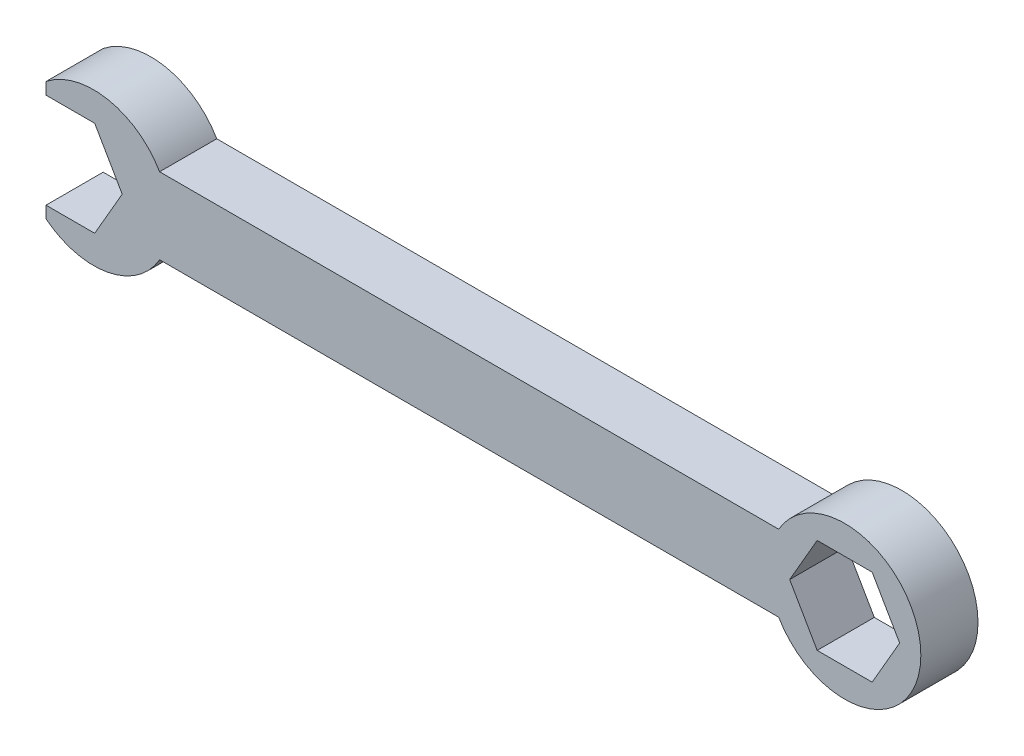
from build123d import *

# Parameters (mm, degrees)
BOSS_EXTRUDE1_DEPTH = 7.62


with BuildPart() as part:
    # Sketch1 → Boss-Extrude1 (new body)
    with BuildSketch(Plane.XY):
        with BuildLine():
            Line((4.988818102, 5.08), (87.538818102, 5.08))
            ThreePointArc((87.538818102, 5.08), (106.497636205, 0), (87.538818102, -5.08))
            Line((87.538818102, -5.08), (4.988818102, -5.08))
            ThreePointArc((4.988818102, -5.08), (-1.930787936, -9.984696391), (-10.16, -7.931147458))
            Line((-10.16, -7.931147458), (-10.16, -6.35))
            Line((-10.16, -6.35), (-3.666174209, -6.35))
            Line((-3.666174209, -6.35), (0, 0))
            Line((0, 0), (-3.666174209, 6.35))
            Line((-3.666174209, 6.35), (-10.16, 6.35))
            Line((-10.16, 6.35), (-10.16, 7.931147458))
            ThreePointArc((-10.16, 7.931147458), (-1.930787936, 9.984696391), (4.988818102, 5.08))
        make_face()
        Polygon((92.671461996, 6.35), (100.003810414, 6.35), (103.669984624, 0), (100.003810414, -6.35), (92.671461996, -6.35), (89.005287786, 0), align=None, mode=Mode.SUBTRACT)
    extrude(amount=BOSS_EXTRUDE1_DEPTH)


solid = part.part
